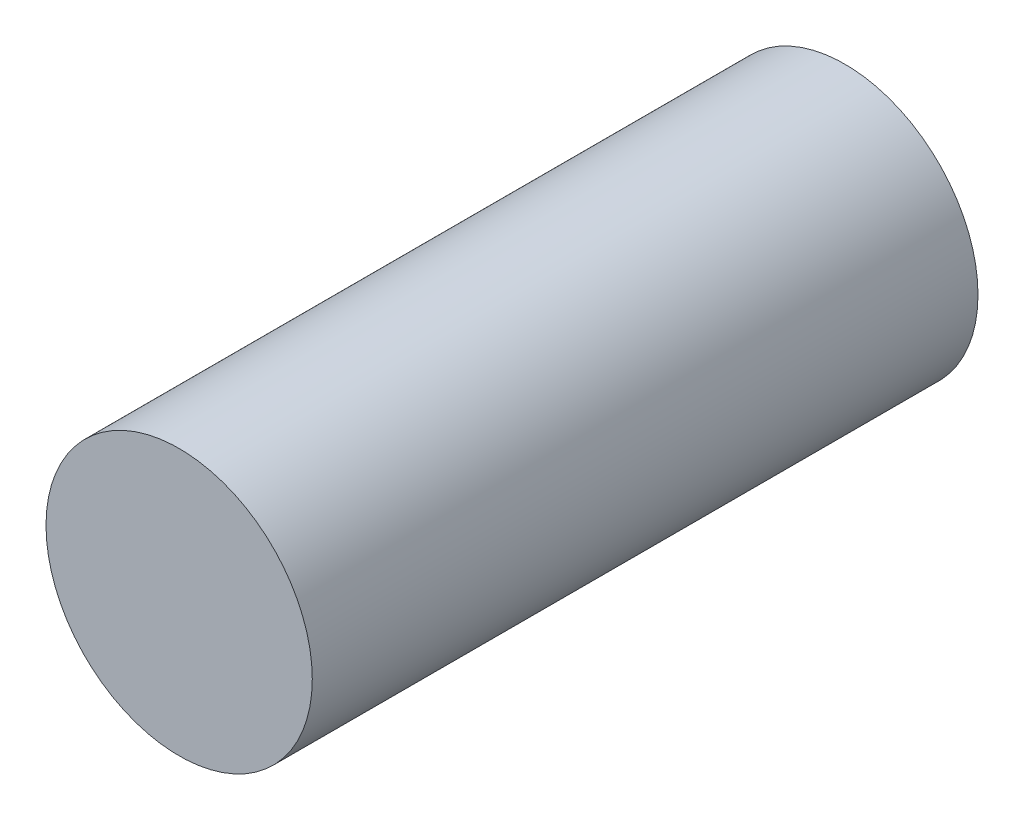
from build123d import *

# Parameters (mm, degrees)
PLANET_PIN_START = 27
SKETCH_1_R       = 4
PLANET_PIN_DEPTH = 20


with BuildPart() as part:
    # Эскиз1 → Planet_pin (new body)
    with BuildSketch(Plane.XY.offset(PLANET_PIN_START)):
        Circle(SKETCH_1_R)
    extrude(amount=PLANET_PIN_DEPTH)


solid = part.part
